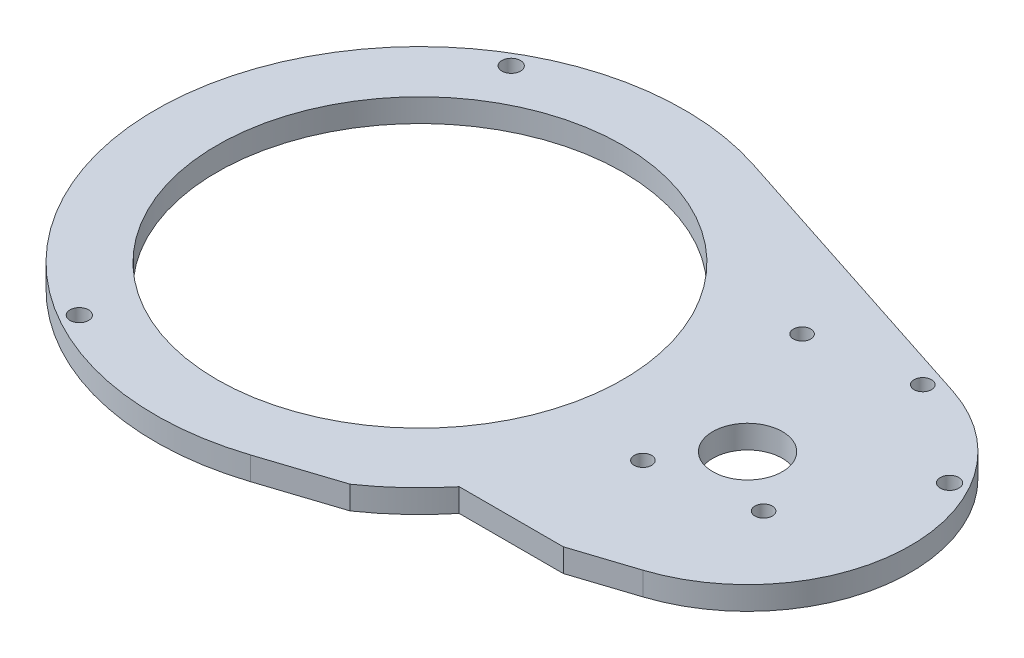
from build123d import *

# Parameters (mm, degrees)
BOSS_EXTRUDE1_DEPTH = 4
SKETCH2_R           = 4.5
SKETCH2_R_2         = 6
CUT_EXTRUDE1_DEPTH  = 10
SKETCH3_R           = 1.6
CUT_EXTRUDE2_DEPTH  = 10
SKETCH4_R           = 35
CUT_EXTRUDE3_DEPTH  = 10
SKETCH5_R           = 1.5
CUT_EXTRUDE4_DEPTH  = 10


with BuildPart() as part:
    # Sketch1 → Boss-Extrude1 (new body)
    with BuildSketch(Plane(origin=(0, 0, 0), x_dir=(1, 0, 0), z_dir=(0, 1, 0))):
        with BuildLine():
            ThreePointArc((14.123893805, 43.357532492), (-45.6, 0), (14.123893805, -43.357532492))
            Line((14.123893805, -43.357532492), (27.105327803, -39.128777194))
            ThreePointArc((27.105327803, -39.128777194), (32.307019566, -34.957352399), (36.874788135, -30.1))
            Line((36.874788135, -30.1), (54.821870135, -30.1))
            Line((54.821870135, -30.1), (65.203539823, -26.718128575))
            ThreePointArc((65.203539823, -26.718128575), (84.6, 0), (65.203539823, 26.718128575))
            Line((65.203539823, 26.718128575), (14.123893805, 43.357532492))
        make_face()
    extrude(amount=BOSS_EXTRUDE1_DEPTH)

    # Sketch2 → Cut-Extrude1 (cut)
    with BuildSketch(Plane(origin=(0, 4, 0), x_dir=(1, 0, 0), z_dir=(0, 1, 0))):
        with Locations(Location((0, 0, 0), (0, 0, 270))):
            Circle(SKETCH2_R)
        with Locations(Location((56.5, 0, 0), (0, 0, 270))):
            Circle(SKETCH2_R_2)
    extrude(amount=-CUT_EXTRUDE1_DEPTH, mode=Mode.SUBTRACT)

    # Sketch3 → Cut-Extrude2 (cut)
    with BuildSketch(Plane(origin=(0, 4, 0), x_dir=(1, 0, 0), z_dir=(0, 1, 0))):
        with Locations(Location((78.583647797, 12.75, 0), (0, 0, 270))):
            Circle(SKETCH3_R)
        with Locations(Location((-21.5, 37.239092363, 0), (0, 0, 270))):
            Circle(SKETCH3_R)
        with Locations(Location((-21.5, -37.239092363, 0), (0, 0, 270))):
            Circle(SKETCH3_R)
    extrude(amount=-CUT_EXTRUDE2_DEPTH, mode=Mode.SUBTRACT)

    # Sketch4 → Cut-Extrude3 (cut)
    with BuildSketch(Plane(origin=(0, 4, 0), x_dir=(1, 0, 0), z_dir=(0, 1, 0))):
        with Locations(Location((0, 0, 0), (0, 0, 270))):
            Circle(SKETCH4_R)
    extrude(amount=-CUT_EXTRUDE3_DEPTH, mode=Mode.SUBTRACT)

    # Sketch5 → Cut-Extrude4 (cut)
    with BuildSketch(Plane(origin=(0, 4, 0), x_dir=(1, 0, 0), z_dir=(0, 1, 0))):
        with Locations(Location((48.781600067, -10.329892746, 0), (0, 0, 270))):
            Circle(SKETCH5_R)
        with Locations(Location((66.758977017, -7.491950177, 0), (0, 0, 270))):
            Circle(SKETCH5_R)
        with Locations(Location((61.613256974, 25.104392643, 0), (0, 0, 270))):
            Circle(SKETCH5_R)
        with Locations(Location((43.635880025, 22.266450075, 0), (0, 0, 270))):
            Circle(SKETCH5_R)
    extrude(amount=-CUT_EXTRUDE4_DEPTH, mode=Mode.SUBTRACT)


solid = part.part
